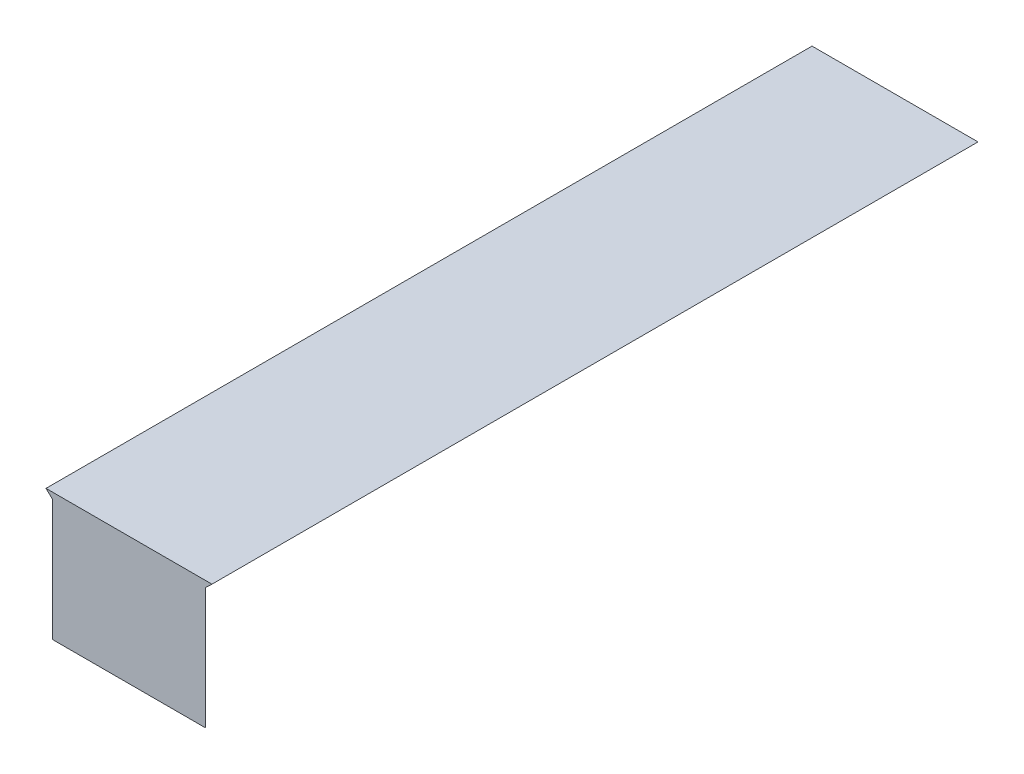
from build123d import *

# Parameters (mm, degrees)
BOSS_EXTRUDE1_DEPTH = 600
BOSS_EXTRUDE2_DEPTH = 100


with BuildPart() as part:
    # Sketch1 → Boss-Extrude1 (new body)
    with BuildSketch(Plane.XY):
        Polygon((-65, 100), (65, 100), (60, 95.25), (45, 81), (-45, 81), (-60, 95.25), align=None)
    extrude(amount=-BOSS_EXTRUDE1_DEPTH)

    # Sketch2 → Boss-Extrude2 (add)
    with BuildSketch(Plane.XZ):
        Polygon((-45, -15), (-60, 0), (60, 0), (45, -15), align=None)
    extrude(amount=-BOSS_EXTRUDE2_DEPTH)


solid = part.part
